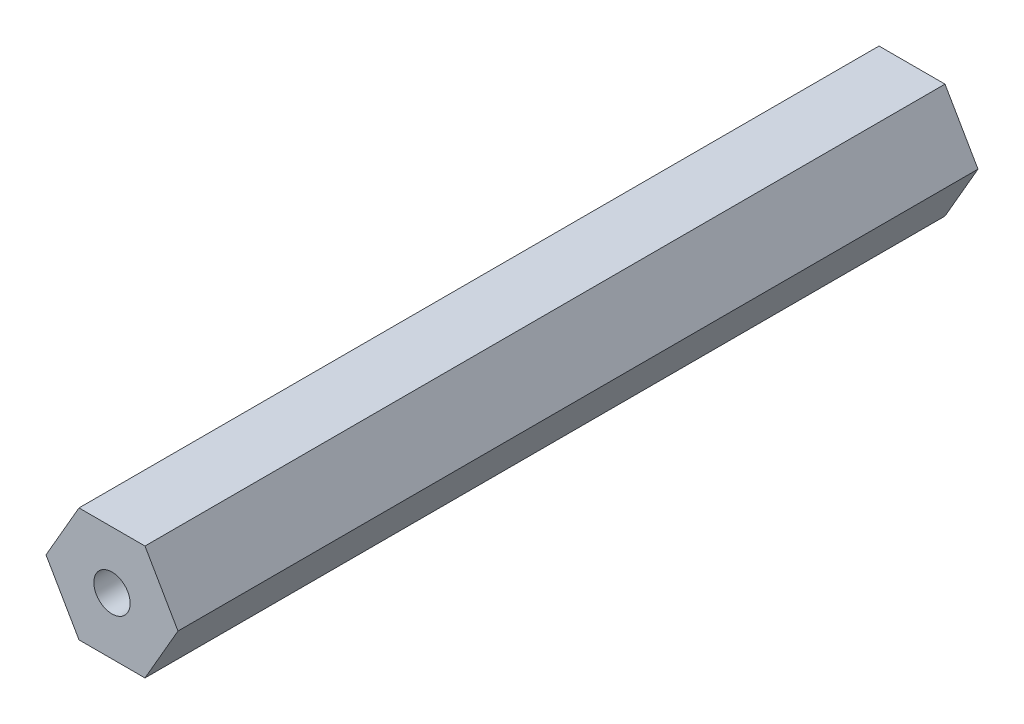
from build123d import *

# Parameters (mm, degrees)
BOSS_EXTRUDE1_DEPTH                  = 44.45
F_10_32_TAPPED_HOLE1_D               = 4.0386
F_10_32_TAPPED_HOLE1_DEPTH           = 11.938
F_10_32_TAPPED_HOLE1_TIP             = 1.213317848
F_10_32_TAPPED_HOLE1_ON_FACE_2_D     = 4.0386
F_10_32_TAPPED_HOLE1_ON_FACE_2_DEPTH = 11.938
F_10_32_TAPPED_HOLE1_ON_FACE_2_TIP   = 1.213317848


with BuildPart() as part:
    # Sketch1 → Boss-Extrude1 (new, symmetric)
    with BuildSketch(Plane.XY):
        Polygon((7.332348419, 0), (3.666174209, 6.35), (-3.666174209, 6.35), (-7.332348419, 0), (-3.666174209, -6.35), (3.666174209, -6.35), align=None)
    extrude(amount=BOSS_EXTRUDE1_DEPTH, both=True)

    # #10-32 Tapped Hole1
    with Locations(Plane.XY.offset(44.45)):
        with Locations((0, 0)):
            Hole(F_10_32_TAPPED_HOLE1_D / 2, depth=F_10_32_TAPPED_HOLE1_DEPTH)
            with Locations((0, 0, -(F_10_32_TAPPED_HOLE1_DEPTH + F_10_32_TAPPED_HOLE1_TIP / 2))):  # 118° drill point
                Cone(0, F_10_32_TAPPED_HOLE1_D / 2, F_10_32_TAPPED_HOLE1_TIP, mode=Mode.SUBTRACT)

    # #10-32 Tapped Hole1 on face 2
    with Locations(Plane(origin=(0, 0, -44.45), x_dir=(-1, 0, 0), z_dir=(0, 0, -1))):
        with Locations((0, 0)):
            Hole(F_10_32_TAPPED_HOLE1_ON_FACE_2_D / 2, depth=F_10_32_TAPPED_HOLE1_ON_FACE_2_DEPTH)
            with Locations((0, 0, -(F_10_32_TAPPED_HOLE1_ON_FACE_2_DEPTH + F_10_32_TAPPED_HOLE1_ON_FACE_2_TIP / 2))):  # 118° drill point
                Cone(0, F_10_32_TAPPED_HOLE1_ON_FACE_2_D / 2, F_10_32_TAPPED_HOLE1_ON_FACE_2_TIP, mode=Mode.SUBTRACT)


solid = part.part
